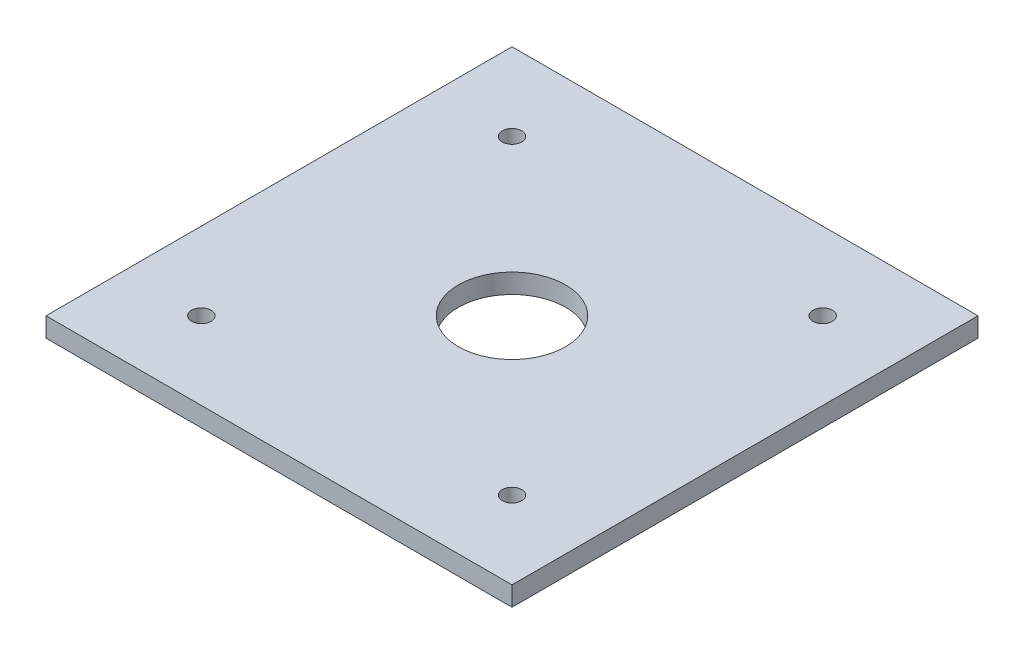
from build123d import *

# Parameters (mm, degrees)
SKETCH1_W                   = 152.4
SKETCH1_H                   = 152.4
SKETCH1_R                   = 17.526
BASE_DEPTH                  = 6.35
F_1_4_0_25_DIAMETER_HOLE1_D = 6.35
CIRPATTERN1_COUNT           = 4


with BuildPart() as part:
    # Sketch1 → Base (new body)
    with BuildSketch(Plane(origin=(0, 0, 0), x_dir=(1, 0, 0), z_dir=(0, 1, 0))):
        Rectangle(SKETCH1_W, SKETCH1_H)
        with Locations(Location((0, 0, 0), (0, 0, 270))):
            Circle(SKETCH1_R, mode=Mode.SUBTRACT)
    extrude(amount=BASE_DEPTH)

    # 1/4 (0.25) Diameter Hole1 (through all)
    with Locations(Plane(origin=(0, 6.35, 0), x_dir=(1, 0, 0), z_dir=(0, 1, 0))):
        with Locations((50.8, -50.8)):
            f_1_4_0_25_diameter_hole1 = Hole(F_1_4_0_25_DIAMETER_HOLE1_D / 2)

    # CirPattern1: 1/4 (0.25) Diameter Hole1 ×4 about axis
    cirpattern1_axis = Axis((0, 0, 0), (0, 1, 0))
    for i in range(1, CIRPATTERN1_COUNT):
        add(f_1_4_0_25_diameter_hole1.rotate(cirpattern1_axis, i * 360 / CIRPATTERN1_COUNT), mode=Mode.SUBTRACT)


solid = part.part
